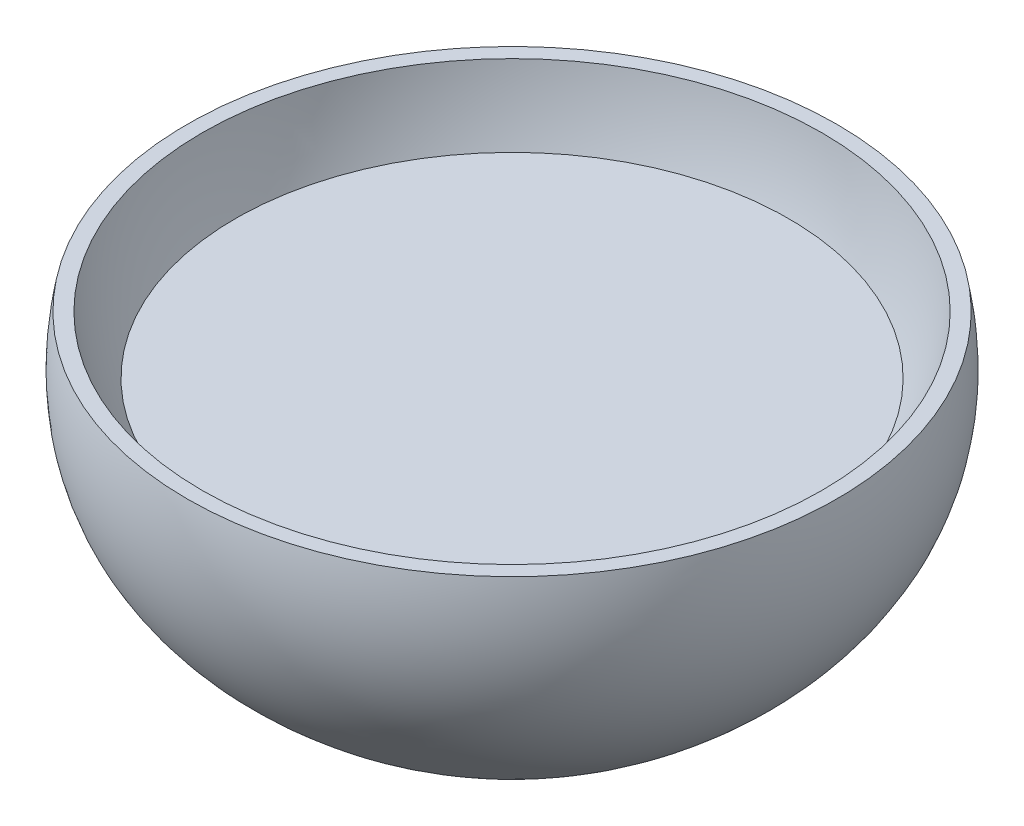
from build123d import *

# Parameters (mm, degrees)
SKETCH2_W           = 5.1730077
SKETCH2_H           = 4.967486285
SKETCH3_R           = 55.958577803
BOSS_EXTRUDE6_DEPTH = 40.894
BOSS_EXTRUDE6_DRAFT = -30
SKETCH4_R           = 55.958577803
CUT_EXTRUDE1_DEPTH  = 10.414
CUT_EXTRUDE1_DRAFT  = -30


with BuildPart() as part:
    # Sketch2 → Revolve6 (revolve)
    with BuildSketch(Plane.XY, mode=Mode.PRIVATE) as revolve6_sk:
        with BuildLine():
            Line((0, 0), (0, 4.967486285))
            ThreePointArc((0, 4.967486285), (33.735351897, 26.125891978), (50.785570102, 62.112586162))
            Line((50.785570102, 62.112586162), (53.467247511, 62.112586162))
            add(Edge.make_bspline(
                [(0, 0), (61.255663305, 20.559397644), (53.467247511, 62.112586162)],
                knots=[0, 0, 0, 1, 1, 1], degree=2))
        make_face()
        with Locations((-2.58650385, 2.483743143)):
            Rectangle(SKETCH2_W, SKETCH2_H)
    revolve(revolve6_sk.sketch.rotate(Axis((-5.1730077, 4.967486285, 0), (0, -1, 0)), 90), axis=Axis((-5.1730077, 4.967486285, 0), (0, -1, 0)))


with BuildPart() as body_2:
    # Sketch3 → Boss-Extrude6 (with draft: the straight prism first)
    with BuildSketch(Plane(origin=(0, 62.112586162, 0), x_dir=(1, 0, 0), z_dir=(0, 1, 0))):
        with Locations((-5.1730077, 0)):
            Circle(SKETCH3_R)
    extrude(amount=-BOSS_EXTRUDE6_DEPTH)
    # Boss-Extrude6: the draft: its side faces are tilted about the plane it starts from
    boss_extrude6_sides = [body_2.faces().sort_by_distance(p)[0] for p in [
        (-61.131585503, 41.665586162, 0),
    ]]
    draft(boss_extrude6_sides, Plane(origin=(0, 62.112586162, 0), x_dir=(1, 0, 0), z_dir=(0, 1, 0)), BOSS_EXTRUDE6_DRAFT)


with BuildPart() as cut_extrude1_tool:
    # Sketch4 → Cut-Extrude1 (with draft: the straight prism first)
    with BuildSketch(Plane(origin=(0, 62.112586162, 0), x_dir=(1, 0, 0), z_dir=(0, 1, 0))):
        with Locations((-5.1730077, 0)):
            Circle(SKETCH4_R)
    extrude(amount=-CUT_EXTRUDE1_DEPTH)
    # Cut-Extrude1: the draft: its side faces are tilted about the plane it starts from
    cut_extrude1_sides = [cut_extrude1_tool.faces().sort_by_distance(p)[0] for p in [
        (-61.131585503, 56.905586162, 0),
    ]]
    draft(cut_extrude1_sides, Plane(origin=(0, 62.112586162, 0), x_dir=(1, 0, 0), z_dir=(0, 1, 0)), CUT_EXTRUDE1_DRAFT)


with BuildPart() as body_2_1:
    add(body_2.part)

    # Cut-Extrude1: cut by cut_extrude1_tool
    add(cut_extrude1_tool.part, mode=Mode.SUBTRACT)


solid = Compound([part.part, body_2_1.part])
